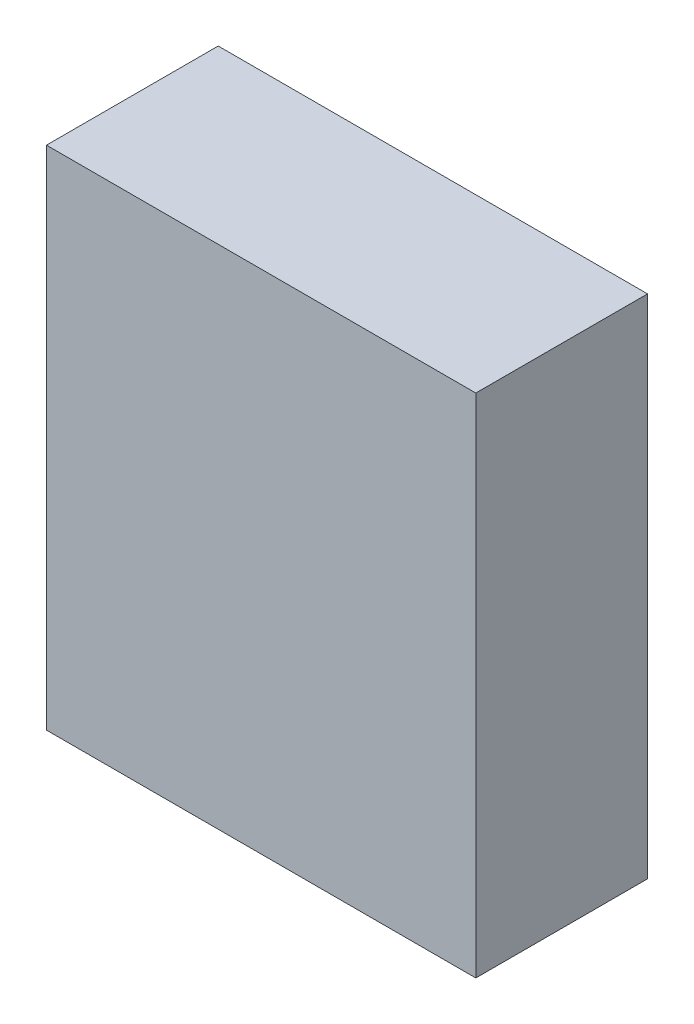
from build123d import *

# Parameters (mm, degrees)
SKETCH_1_W      = 100
SKETCH_1_H      = 118
EXTRUDE_1_DEPTH = 40


with BuildPart() as part:
    # Эскиз1 → Бобышка-Вытянуть1 (new body)
    with BuildSketch(Plane.XY):
        Rectangle(SKETCH_1_W, SKETCH_1_H)
    extrude(amount=EXTRUDE_1_DEPTH)


solid = part.part
